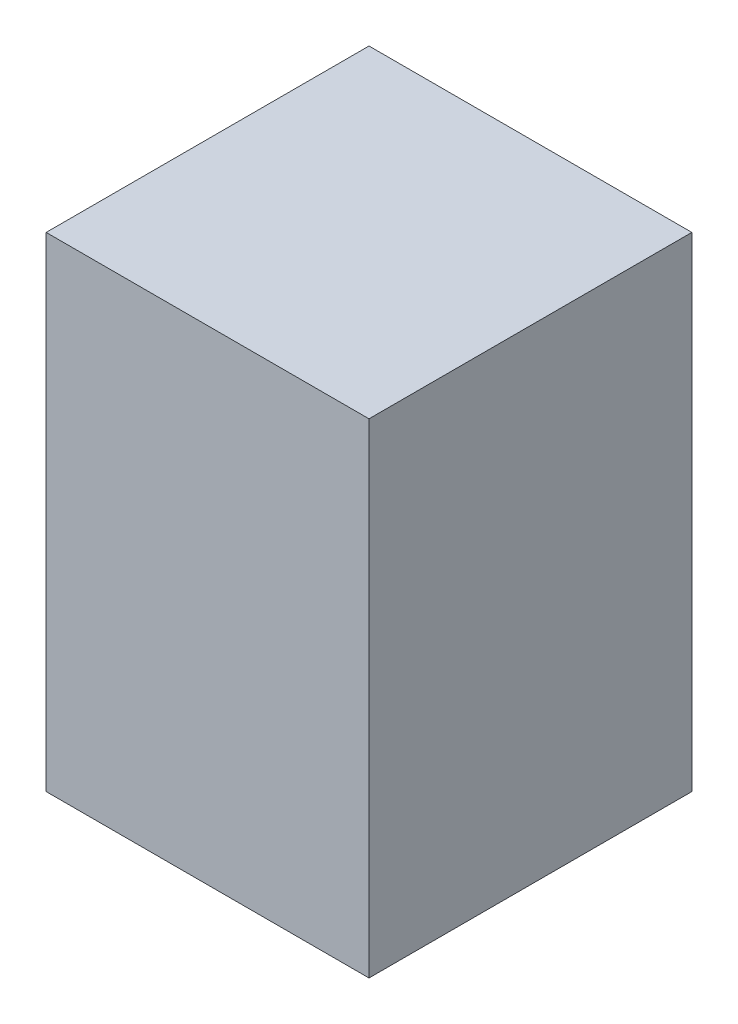
from build123d import *

# Parameters (mm, degrees)
STORE_AYAK_2_1_START = -40
SKETCH1_W            = 80
SKETCH1_H            = 120
STORE_AYAK_2_1_DEPTH = 80


with BuildPart() as part:
    # Sketch1 → STORE_ayak_2_1 (new body)
    with BuildSketch(Plane.XY.offset(STORE_AYAK_2_1_START)):
        with Locations((1300, 60)):
            Rectangle(SKETCH1_W, SKETCH1_H)
    extrude(amount=-STORE_AYAK_2_1_DEPTH)


solid = part.part
